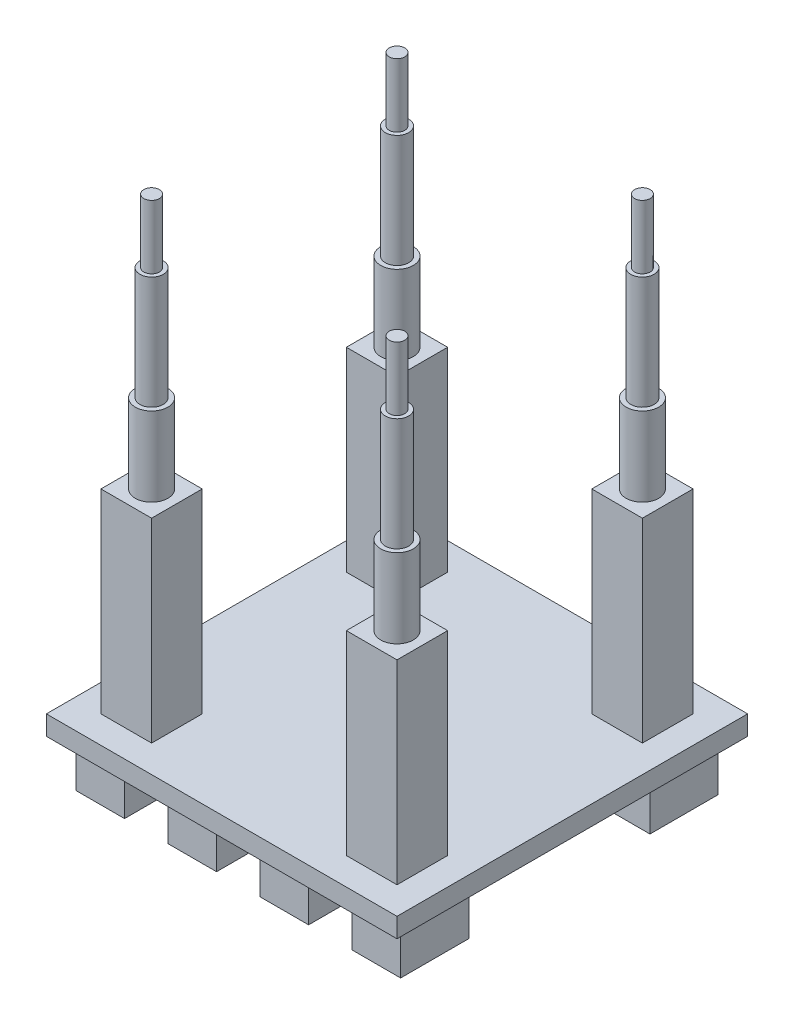
from build123d import *

# Parameters (mm, degrees)
SKETCH1_W           = 45.72
SKETCH1_H           = 45.72
BOSS_EXTRUDE1_DEPTH = 2.54
SKETCH2_W           = 6.604
SKETCH2_H           = 6.604
BOSS_EXTRUDE2_DEPTH = 25.4
SKETCH5_R           = 2.125
BOSS_EXTRUDE5_DEPTH = 10.3
SKETCH8_R           = 1.525
BOSS_EXTRUDE8_DEPTH = 14.7
SKETCH9_R           = 1.015
BOSS_EXTRUDE9_DEPTH = 8.3
SKETCH7_W           = 6.35
SKETCH7_H           = 8.89
BOSS_EXTRUDE7_DEPTH = 6.35


with BuildPart() as part:
    # Sketch1 → Boss-Extrude1 (new body)
    with BuildSketch(Plane(origin=(0, 0, 0), x_dir=(1, 0, 0), z_dir=(0, 1, 0))):
        Rectangle(SKETCH1_W, SKETCH1_H)
    extrude(amount=BOSS_EXTRUDE1_DEPTH)

    # Sketch2 → Boss-Extrude2 (add)
    with BuildSketch(Plane(origin=(0, 2.54, 0), x_dir=(1, 0, 0), z_dir=(0, 1, 0))):
        with Locations((16.000000004, 16.000000004)):
            Rectangle(SKETCH2_W, SKETCH2_H)
        with Locations((-16.000000004, 16.000000004)):
            Rectangle(SKETCH2_W, SKETCH2_H)
        with Locations((-16.000000004, -16.000000004)):
            Rectangle(SKETCH2_W, SKETCH2_H)
        with Locations((16.000000004, -16.000000004)):
            Rectangle(SKETCH2_W, SKETCH2_H)
    extrude(amount=BOSS_EXTRUDE2_DEPTH)

    # Sketch5 → Boss-Extrude5 (add)
    with BuildSketch(Plane(origin=(0, 27.94, 0), x_dir=(1, 0, 0), z_dir=(0, 1, 0))):
        with Locations(Location((-16.000000004, 16.000000004, 0), (0, 0, 90))):
            Circle(SKETCH5_R)
        with Locations(Location((16.000000004, 16.000000004, 0), (0, 0, 90))):
            Circle(SKETCH5_R)
        with Locations(Location((-16.000000004, -16.000000004, 0), (0, 0, 90))):
            Circle(SKETCH5_R)
        with Locations(Location((16.000000004, -16.000000004, 0), (0, 0, 90))):
            Circle(SKETCH5_R)
    extrude(amount=BOSS_EXTRUDE5_DEPTH)

    # Sketch8 → Boss-Extrude8 (add)
    with BuildSketch(Plane(origin=(0, 38.24, 0), x_dir=(1, 0, 0), z_dir=(0, 1, 0))):
        with Locations(Location((16, 16, 0), (0, 0, 270))):
            Circle(SKETCH8_R)
        with Locations(Location((-16, 16, 0), (0, 0, 90))):
            Circle(SKETCH8_R)
        with Locations(Location((-16, -16, 0), (0, 0, 270))):
            Circle(SKETCH8_R)
        with Locations(Location((16, -16, 0), (0, 0, 90))):
            Circle(SKETCH8_R)
    extrude(amount=BOSS_EXTRUDE8_DEPTH)

    # Sketch9 → Boss-Extrude9 (add)
    with BuildSketch(Plane(origin=(0, 52.94, 0), x_dir=(1, 0, 0), z_dir=(0, 1, 0))):
        with Locations(Location((16, 16, 0), (0, 0, 90))):
            Circle(SKETCH9_R)
        with Locations(Location((-16, 16, 0), (0, 0, 90))):
            Circle(SKETCH9_R)
        with Locations(Location((-16, -16, 0), (0, 0, 90))):
            Circle(SKETCH9_R)
        with Locations(Location((16, -16, 0), (0, 0, 90))):
            Circle(SKETCH9_R)
    extrude(amount=BOSS_EXTRUDE9_DEPTH)

    # Sketch7 → Boss-Extrude7 (add)
    with BuildSketch(Plane.XZ):
        with Locations((-6, 16.256)):
            Rectangle(SKETCH7_W, SKETCH7_H)
        with Locations((-18, 16.256)):
            Rectangle(SKETCH7_W, SKETCH7_H)
        with Locations((6, 16.256)):
            Rectangle(SKETCH7_W, SKETCH7_H)
        with Locations((18, 16.256)):
            Rectangle(SKETCH7_W, SKETCH7_H)
        with Locations((-6, -16.256)):
            Rectangle(SKETCH7_W, SKETCH7_H)
        with Locations((-18, -16.256)):
            Rectangle(SKETCH7_W, SKETCH7_H)
        with Locations((18, -16.256)):
            Rectangle(SKETCH7_W, SKETCH7_H)
        with Locations((6, -16.256)):
            Rectangle(SKETCH7_W, SKETCH7_H)
    extrude(amount=BOSS_EXTRUDE7_DEPTH)


solid = part.part
